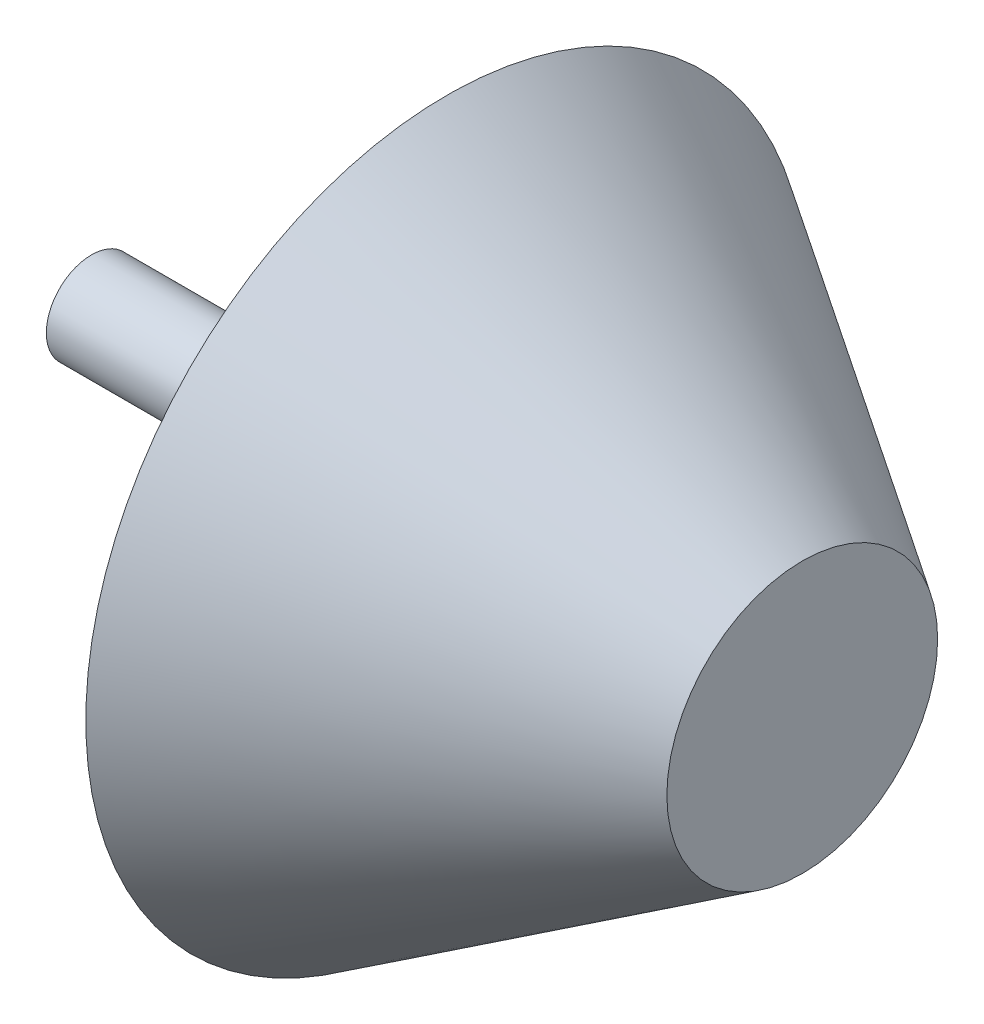
from build123d import *

# Parameters (mm, degrees)
SKETCH2_R           = 101.6
SKETCH3_R           = 38.1
SKETCH4_R           = 12.7
BOSS_EXTRUDE1_DEPTH = 100


with BuildPart() as part:
    # Sketch2 → Loft1 section 0
    with BuildSketch(Plane.YZ):
        Circle(SKETCH2_R)
    # Sketch3 → Loft1 section 1
    with BuildSketch(Plane.YZ.offset(100)):
        Circle(SKETCH3_R)
    loft()

    # Sketch4 → Boss-Extrude1 (add)
    with BuildSketch(Plane(origin=(0, 0, 0), x_dir=(0, -1, 0), z_dir=(-1, 0, 0))):
        with Locations(Location((0, 0, 0), (0, 0, 270))):
            Circle(SKETCH4_R)
    extrude(amount=BOSS_EXTRUDE1_DEPTH)


solid = part.part
